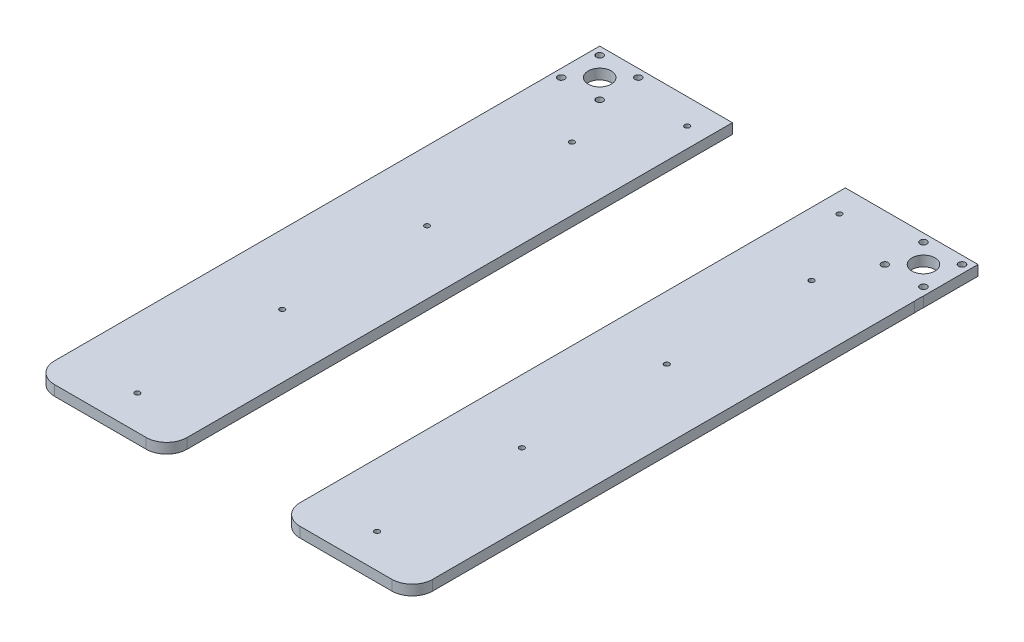
from build123d import *

# Parameters (mm, degrees)
CROQUIS1_R                = 1.5
CROQUIS1_R_2              = 2
CROQUIS1_R_3              = 6.75
SALIENTE_EXTRUIR1_DEPTH   = 6
SALIENTE_EXTRUIR1_2_DEPTH = 6


with BuildPart() as part:
    # Croquis1 → Saliente-Extruir1 (new body)
    with BuildSketch(Plane(origin=(0, 0, 0), x_dir=(1, 0, 0), z_dir=(0, 1, 0))):
        with BuildLine():
            Line((106.967839575, 132.109924801), (106.967839575, 164.109924801))
            Line((106.967839575, 164.109924801), (29.104968861, 164.109924801))
            Line((29.104968861, 164.109924801), (29.104968861, -155.890075199))
            ThreePointArc((29.104968861, -155.890075199), (32.619687487, -164.375356573), (41.104968861, -167.890075199))
            Line((41.104968861, -167.890075199), (94.967839575, -167.890075199))
            ThreePointArc((94.967839575, -167.890075199), (103.45312095, -164.375356573), (106.967839575, -155.890075199))
            Line((106.967839575, -155.890075199), (106.967839575, 126.727593434))
            ThreePointArc((106.967839575, 126.727593434), (106.892367598, 129.418759117), (106.967839575, 132.109924801))
        make_face()
        with Locations(Location((66.300038828, -147.890075199, 0), (0, 0, 270))):
            Circle(CROQUIS1_R, mode=Mode.SUBTRACT)
        with Locations(Location((66.300038828, -62.890075199, 0), (0, 0, 270))):
            Circle(CROQUIS1_R, mode=Mode.SUBTRACT)
        with Locations(Location((66.300038828, 22.109924801, 0), (0, 0, 270))):
            Circle(CROQUIS1_R, mode=Mode.SUBTRACT)
        with Locations(Location((40.63223808, 149.109924801, 0), (0, 0, 270))):
            Circle(CROQUIS1_R, mode=Mode.SUBTRACT)
        with Locations(Location((66.300038828, 107.109924801, 0), (0, 0, 270))):
            Circle(CROQUIS1_R, mode=Mode.SUBTRACT)
        with Locations(Location((79.654131076, 136.796216302, 0), (0, 0, 270))):
            Circle(CROQUIS1_R_2, mode=Mode.SUBTRACT)
        with Locations(Location((102.281548074, 136.796216302, 0), (0, 0, 270))):
            Circle(CROQUIS1_R_2, mode=Mode.SUBTRACT)
        with Locations(Location((90.967839575, 148.109924801, 0), (0, 0, 270))):
            Circle(CROQUIS1_R_3, mode=Mode.SUBTRACT)
        with Locations(Location((79.654131076, 159.4236333, 0), (0, 0, 270))):
            Circle(CROQUIS1_R_2, mode=Mode.SUBTRACT)
        with Locations(Location((102.281548074, 159.4236333, 0), (0, 0, 270))):
            Circle(CROQUIS1_R_2, mode=Mode.SUBTRACT)
    extrude(amount=SALIENTE_EXTRUIR1_DEPTH)


with BuildPart() as body_2:
    # Croquis1 → Saliente-Extruir1 2 (new body)
    with BuildSketch(Plane(origin=(0, 0, 0), x_dir=(1, 0, 0), z_dir=(0, 1, 0))):
        with BuildLine():
            Line((-37.16928971, 164.109924801), (-115.032160425, 164.109924801))
            Line((-115.032160425, 164.109924801), (-115.032160425, 132.109924801))
            ThreePointArc((-115.032160425, 132.109924801), (-114.956688447, 129.418759117), (-115.032160425, 126.727593433))
            Line((-115.032160425, 126.727593433), (-115.032160425, -155.890075199))
            ThreePointArc((-115.032160425, -155.890075199), (-111.517441799, -164.375356573), (-103.032160425, -167.890075199))
            Line((-103.032160425, -167.890075199), (-49.16928971, -167.890075199))
            ThreePointArc((-49.16928971, -167.890075199), (-40.684008336, -164.375356573), (-37.16928971, -155.890075199))
            Line((-37.16928971, -155.890075199), (-37.16928971, 164.109924801))
        make_face()
        with Locations(Location((-74.364359677, -147.890075199, 0), (0, 0, 270))):
            Circle(CROQUIS1_R, mode=Mode.SUBTRACT)
        with Locations(Location((-74.364359677, -62.890075199, 0), (0, 0, 270))):
            Circle(CROQUIS1_R, mode=Mode.SUBTRACT)
        with Locations(Location((-74.364359677, 22.109924801, 0), (0, 0, 270))):
            Circle(CROQUIS1_R, mode=Mode.SUBTRACT)
        with Locations(Location((-74.364359677, 107.109924801, 0), (0, 0, 270))):
            Circle(CROQUIS1_R, mode=Mode.SUBTRACT)
        with Locations(Location((-110.345868924, 136.796216302, 0), (0, 0, 270))):
            Circle(CROQUIS1_R_2, mode=Mode.SUBTRACT)
        with Locations(Location((-87.718451926, 136.796216302, 0), (0, 0, 270))):
            Circle(CROQUIS1_R_2, mode=Mode.SUBTRACT)
        with Locations(Location((-110.345868924, 159.4236333, 0), (0, 0, 270))):
            Circle(CROQUIS1_R_2, mode=Mode.SUBTRACT)
        with Locations(Location((-99.032160425, 148.109924801, 0), (0, 0, 270))):
            Circle(CROQUIS1_R_3, mode=Mode.SUBTRACT)
        with Locations(Location((-87.718451926, 159.4236333, 0), (0, 0, 270))):
            Circle(CROQUIS1_R_2, mode=Mode.SUBTRACT)
        with Locations(Location((-48.696558929, 149.109924801, 0), (0, 0, 270))):
            Circle(CROQUIS1_R, mode=Mode.SUBTRACT)
    extrude(amount=SALIENTE_EXTRUIR1_2_DEPTH)


solid = Compound([part.part, body_2.part])
